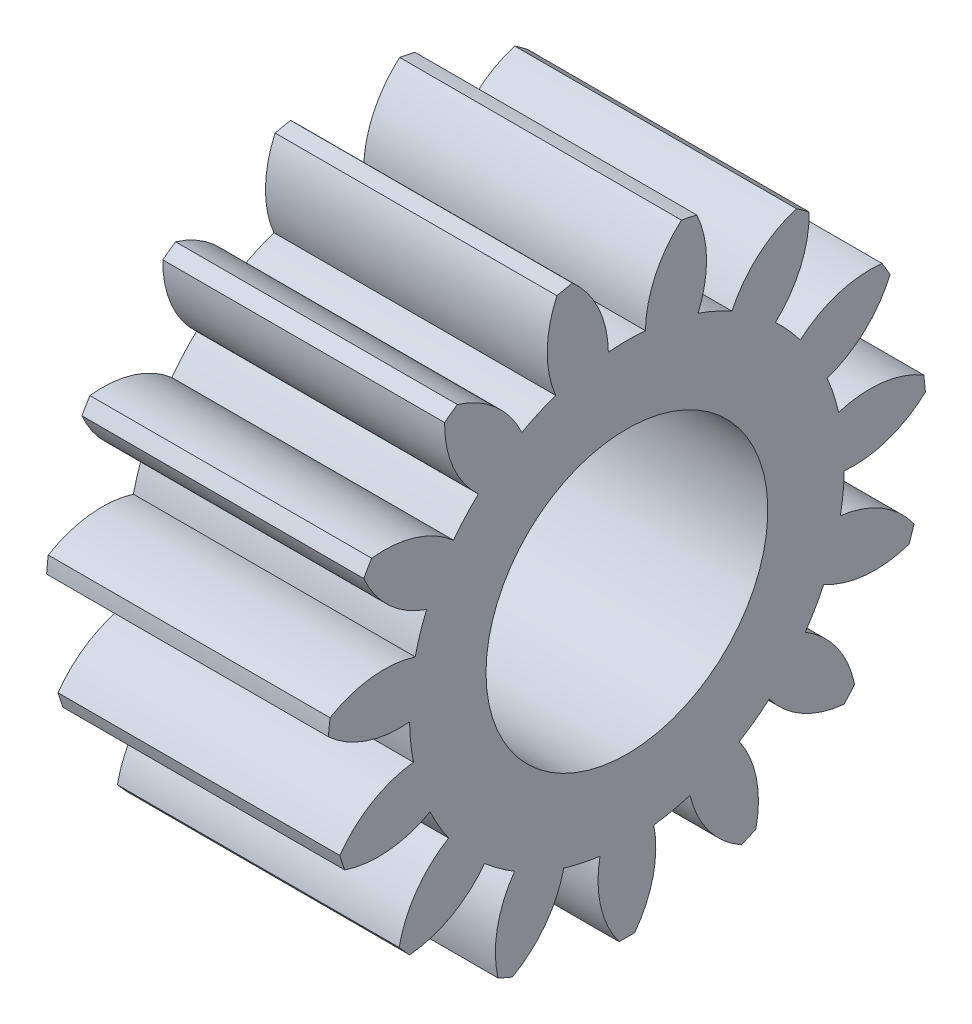
from build123d import *

# Parameters (mm, degrees)
BASPROSKE_W     = 3.175
BASPROSKE_H     = 3.3734375
TOOTHCUT_DEPTH  = 6.730688103
TEETHCUTS_COUNT = 15
TEETHCUTS_ANGLE = 336
BORSKE_R        = 1.5875
BORE_DEPTH      = 50.8000508


with BuildPart() as part:
    # BasProSke → Base-Revolve (revolve)
    with BuildSketch(Plane(origin=(0, 0, 0), x_dir=(1, 0, 0), z_dir=(0, 1, 0)), mode=Mode.PRIVATE) as base_revolve_sk:
        with Locations((1.5875, 1.68671875)):
            Rectangle(BASPROSKE_W, BASPROSKE_H)
    revolve(base_revolve_sk.sketch.rotate(Axis((-10, 0, 0), (1, 0, 0)), 180), axis=Axis((-10, 0, 0), (1, 0, 0)))

    # TooCutSke → ToothCut (cut, through all)
    with BuildSketch(Plane(origin=(0, 0, 0), x_dir=(0, 0, -1), z_dir=(1, 0, 0))):
        with BuildLine():
            ThreePointArc((0.208843157, 2.440593375), (0, 2.4495125), (-0.208843157, 2.440593375))
            ThreePointArc((-0.208843157, 2.440593375), (-0.325677242, 2.936523576), (-0.6391232, 3.338205789))
            ThreePointArc((-0.6391232, 3.338205789), (0, 3.3988375), (0.6391232, 3.338205789))
            ThreePointArc((0.6391232, 3.338205789), (0.325677242, 2.936523576), (0.208843157, 2.440593375))
        make_face()
    toothcut = extrude(amount=TOOTHCUT_DEPTH, mode=Mode.SUBTRACT)

    # TeethCuts: ToothCut ×15 about axis
    teethcuts_axis = Axis((-10, 0, 0), (1, 0, 0))
    for i in range(1, TEETHCUTS_COUNT):
        add(toothcut.rotate(teethcuts_axis, i * TEETHCUTS_ANGLE / (TEETHCUTS_COUNT - 1)), mode=Mode.SUBTRACT)

    # BorSke → Bore (cut, symmetric)
    with BuildSketch(Plane(origin=(0, 0, 0), x_dir=(0, 0, -1), z_dir=(1, 0, 0))):
        with Locations(Location((0, 0, 0), (0, 0, 180))):
            Circle(BORSKE_R)
    extrude(amount=BORE_DEPTH, both=True, mode=Mode.SUBTRACT)


solid = part.part
